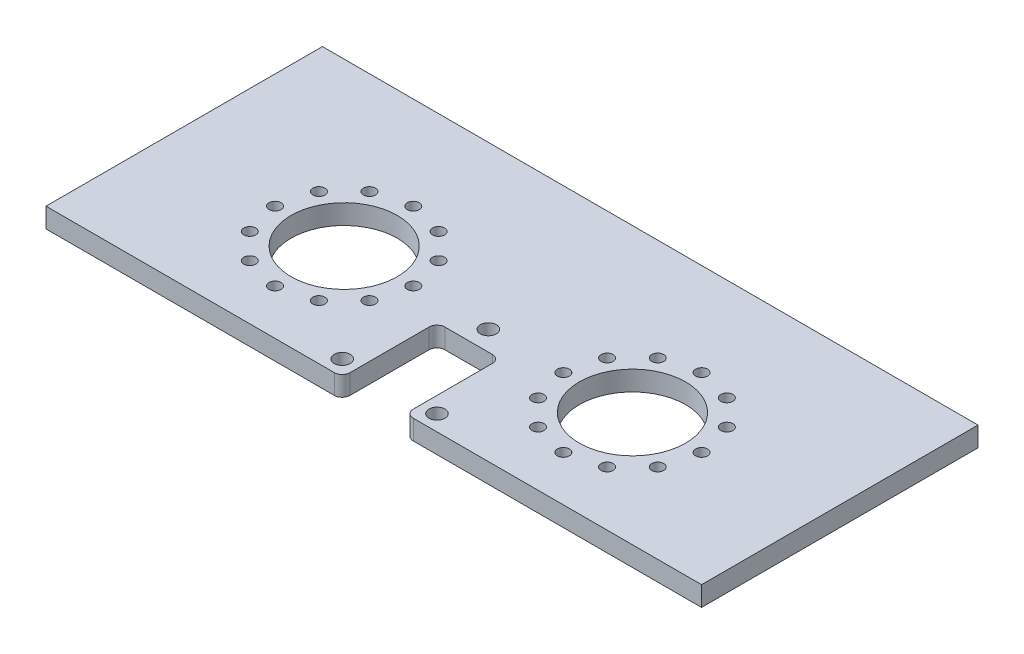
from build123d import *

# Parameters (mm, degrees)
SKETCH_1_W          = 166
SKETCH_1_H          = 70
EXTRUDE_1_DEPTH     = 5
SKETCH_2_R          = 2.025
CUT_EXTRUDE_1_DEPTH = 5
SKETCH_3_R          = 1.525
SKETCH_3_R_2        = 13.45
CUT_EXTRUDE_2_DEPTH = 81.4
SKETCH_5_W          = 16
SKETCH_5_H          = 48
CUT_EXTRUDE_4_DEPTH = 81.4
FILLET_2_R          = 2


with BuildPart() as part:
    # 草图1 → 凸台-拉伸1 (new body)
    with BuildSketch(Plane(origin=(0, 0, 0), x_dir=(1, 0, 0), z_dir=(0, 1, 0))):
        Rectangle(SKETCH_1_W, SKETCH_1_H)
    extrude(amount=EXTRUDE_1_DEPTH)

    # 草图2 → 切除-拉伸1 (cut)
    with BuildSketch(Plane.XZ):
        with Locations(Location((-12, 31, 0), (0, 0, 270))):
            Circle(SKETCH_2_R)
        with Locations(Location((12, 31, 0), (0, 0, 270))):
            Circle(SKETCH_2_R)
        with Locations(Location((0, 6, 0), (0, 0, 270))):
            Circle(SKETCH_2_R)
    extrude(amount=-CUT_EXTRUDE_1_DEPTH, mode=Mode.SUBTRACT)

    # 草图3 → 切除-拉伸2 (cut)
    with BuildSketch(Plane.XZ):
        with Locations(Location((36.5, 23.5, 0), (0, 0, 270))):
            Circle(SKETCH_3_R)
        with Locations(Location((45.25, 21.155444566, 0), (0, 0, 270))):
            Circle(SKETCH_3_R)
        with Locations(Location((51.655444566, 14.75, 0), (0, 0, 270))):
            Circle(SKETCH_3_R)
        with Locations(Location((54, 6, 0), (0, 0, 270))):
            Circle(SKETCH_3_R)
        with Locations(Location((51.655444566, -2.75, 0), (0, 0, 270))):
            Circle(SKETCH_3_R)
        with Locations(Location((45.25, -9.155444566, 0), (0, 0, 270))):
            Circle(SKETCH_3_R)
        with Locations(Location((36.5, -11.5, 0), (0, 0, 270))):
            Circle(SKETCH_3_R)
        with Locations(Location((27.75, -9.155444566, 0), (0, 0, 270))):
            Circle(SKETCH_3_R)
        with Locations(Location((21.344555434, -2.75, 0), (0, 0, 270))):
            Circle(SKETCH_3_R)
        with Locations(Location((19, 6, 0), (0, 0, 270))):
            Circle(SKETCH_3_R)
        with Locations(Location((21.344555434, 14.75, 0), (0, 0, 270))):
            Circle(SKETCH_3_R)
        with Locations(Location((27.75, 21.155444566, 0), (0, 0, 270))):
            Circle(SKETCH_3_R)
        with Locations(Location((36.5, 6, 0), (0, 0, 270))):
            Circle(SKETCH_3_R_2)
    cut_extrude_2 = extrude(amount=-CUT_EXTRUDE_2_DEPTH, mode=Mode.SUBTRACT)

    # 镜向1: 切除-拉伸2 across plane
    add(cut_extrude_2.mirror(Plane(origin=(0, 0, 0), x_dir=(0, 0, 1), z_dir=(1, 0, 0))), mode=Mode.SUBTRACT)

    # 草图5 → 切除-拉伸4 (cut)
    with BuildSketch(Plane.XZ):
        with Locations((0, 35)):
            Rectangle(SKETCH_5_W, SKETCH_5_H)
    extrude(amount=-CUT_EXTRUDE_4_DEPTH, mode=Mode.SUBTRACT)

    # 圆角2
    fillet_2_edges = [part.edges().sort_by_distance(p)[0] for p in [
        (8, 2.5, 35),
        (8, 2.5, 11),
        (-8, 2.5, 35),
        (-8, 2.5, 11),
    ]]
    fillet(fillet_2_edges, radius=FILLET_2_R)


solid = part.part
